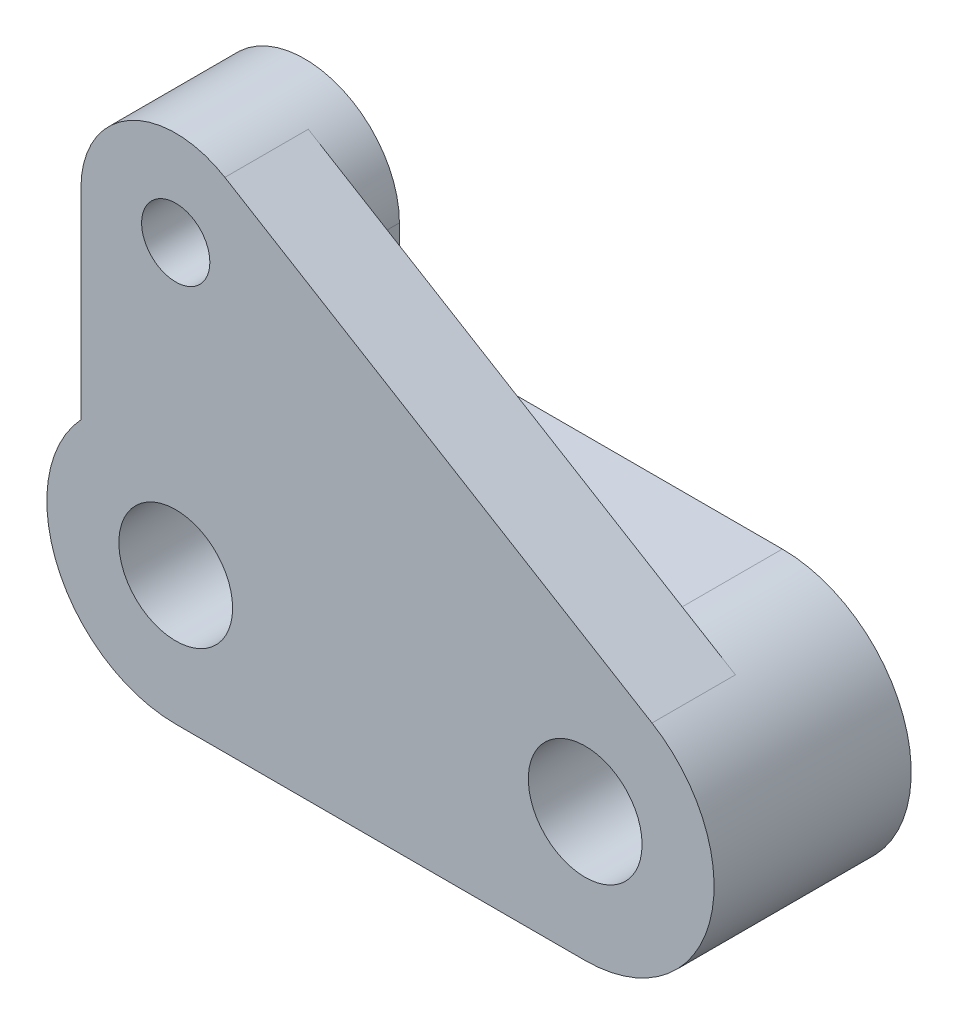
from build123d import *

# Parameters (mm, degrees)
BOSS_EXTRUDE1_DEPTH = 26
SKETCH2_R           = 15
CUT_EXTRUDE1_DEPTH  = 108.721864076
SKETCH3_R           = 25
SKETCH3_R_2         = 9
BOSS_EXTRUDE2_DEPTH = 34
BOSS_EXTRUDE3_DEPTH = 34
FILLET1_R           = 15
BOSS_EXTRUDE4_DEPTH = 22


with BuildPart() as part:
    # Sketch1 → Boss-Extrude1 (new, symmetric)
    with BuildSketch(Plane.XY):
        with BuildLine():
            Line((-54, 34), (54, 34))
            ThreePointArc((54, 34), (88, 0), (54, -34))
            Line((54, -34), (-54, -34))
            ThreePointArc((-54, -34), (-88, 0), (-54, 34))
        make_face()
    extrude(amount=BOSS_EXTRUDE1_DEPTH, both=True)

    # Sketch2 → Cut-Extrude1 (cut, through all)
    with BuildSketch(Plane.XY.offset(26)):
        with Locations((54, 0)):
            Circle(SKETCH2_R)
        with Locations((-54, 0)):
            Circle(SKETCH2_R)
    extrude(amount=-CUT_EXTRUDE1_DEPTH, mode=Mode.SUBTRACT)



with BuildPart() as body_2:
    # Sketch3 → Boss-Extrude2 (new body)
    with BuildSketch(Plane.XY.offset(26)):
        with Locations((-54, 76)):
            Circle(SKETCH3_R)
        with Locations((-54, 76)):
            Circle(SKETCH3_R_2, mode=Mode.SUBTRACT)
    extrude(amount=-BOSS_EXTRUDE2_DEPTH)


with BuildPart() as part_1:
    add(part.part)

    add(body_2.part)  # Boss-Extrude3 merges body 2
    # Sketch4 → Boss-Extrude3 (add)
    with BuildSketch(Plane.XY.offset(26)):
        with BuildLine():
            Line((-79, 76), (-79, 23.043437244))
            ThreePointArc((-79, 23.043437244), (-67.647767834, 31.140623519), (-54, 34))
            Line((-54, 34), (-29, 34))
            Line((-29, 34), (-29, 76))
            ThreePointArc((-29, 76), (-54, 51), (-79, 76))
        make_face()
    extrude(amount=-BOSS_EXTRUDE3_DEPTH)

    # Fillet1
    fillet1_edges = [part_1.edges().sort_by_distance(p)[0] for p in [
        (-29, 34, 9),
    ]]
    fillet(fillet1_edges, radius=FILLET1_R)

    # Sketch5 → Boss-Extrude4 (add)
    with BuildSketch(Plane.XY.offset(26)):
        with BuildLine():
            Line((-41.03946331, 97.378131086), (71.626329898, 29.074258276))
            ThreePointArc((71.626329898, 29.074258276), (63.150825608, 32.745417858), (54, 34))
            Line((54, 34), (-14, 34))
            ThreePointArc((-14, 34), (-24.606601718, 38.393398282), (-29, 49))
            Line((-29, 49), (-29, 76))
            ThreePointArc((-29, 76), (-32.216825102, 88.26757072), (-41.03946331, 97.378131086))
        make_face()
    extrude(amount=-BOSS_EXTRUDE4_DEPTH)


solid = part_1.part
